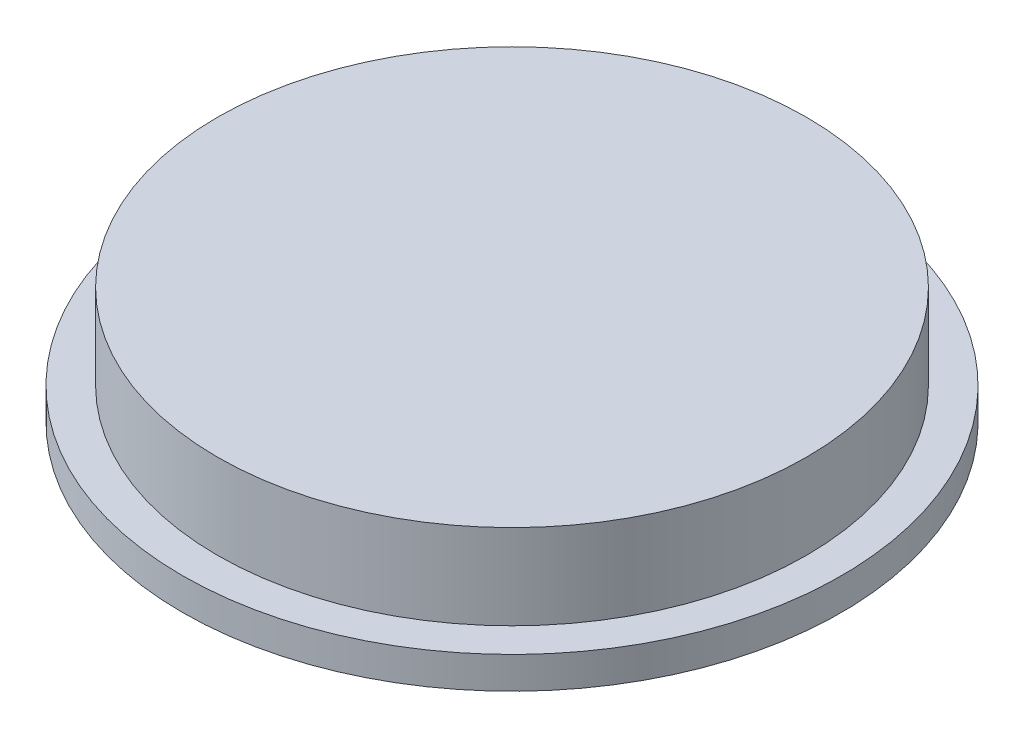
from build123d import *


with BuildPart() as part:
    # Croquis2 → Revolución1 (revolve)
    with BuildSketch(Plane.XY, mode=Mode.PRIVATE) as revoluci_n1_sk:
        Polygon((0, 0), (-15.5, 0), (-15.5, 1.5), (-13.85, 1.5), (-13.85, 5.5), (0, 5.5), align=None)
    revolve(revoluci_n1_sk.sketch.rotate(Axis((0, 5.5, 0), (0, -1, 0)), 270), axis=Axis((0, 5.5, 0), (0, -1, 0)))


solid = part.part
